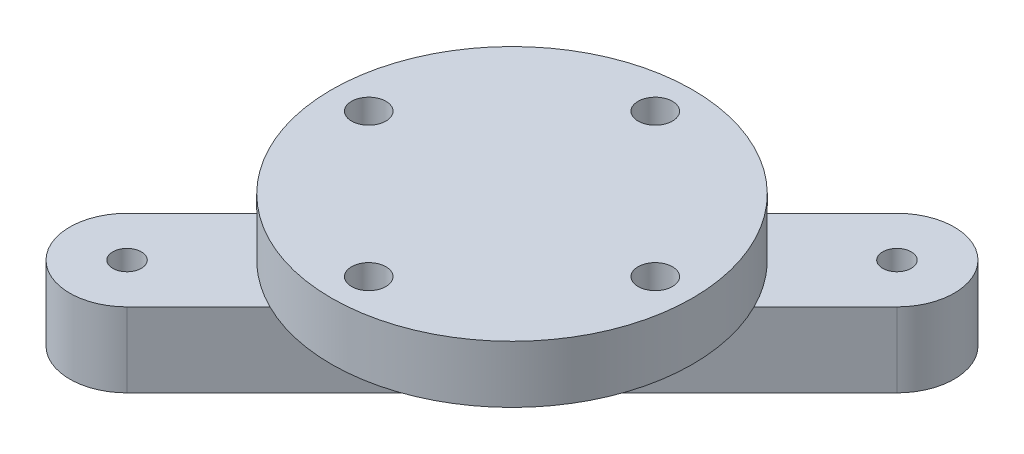
from build123d import *

# Parameters (mm, degrees)
SKETCH1_R           = 31.5
BOSS_EXTRUDE4_DEPTH = 10
SKETCH3_R           = 3
CUT_EXTRUDE2_DEPTH  = 10
SKETCH4_R           = 5
CUT_EXTRUDE3_DEPTH  = 5
SKETCH5_R           = 2.5
BOSS_EXTRUDE5_DEPTH = 13


with BuildPart() as part:
    # Sketch1 → Boss-Extrude4 (new body)
    with BuildSketch(Plane(origin=(0, 0, 0), x_dir=(1, 0, 0), z_dir=(0, 1, 0))):
        with Locations(Location((0, 0, 0), (0, 0, 270))):
            Circle(SKETCH1_R)
    extrude(amount=BOSS_EXTRUDE4_DEPTH)

    # Sketch3 → Cut-Extrude2 (cut)
    with BuildSketch(Plane(origin=(0, 0, 0), x_dir=(1, 0, 0), z_dir=(0, 1, 0))):
        with Locations(Location((0, 25, 0), (0, 0, 270))):
            Circle(SKETCH3_R)
        with Locations(Location((25, 0, 0), (0, 0, 270))):
            Circle(SKETCH3_R)
        with Locations(Location((0, -25, 0), (0, 0, 270))):
            Circle(SKETCH3_R)
        with Locations(Location((-25, 0, 0), (0, 0, 270))):
            Circle(SKETCH3_R)
    extrude(amount=CUT_EXTRUDE2_DEPTH, mode=Mode.SUBTRACT)

    # Sketch4 → Cut-Extrude3 (cut)
    with BuildSketch(Plane(origin=(0, 0, 0), x_dir=(1, 0, 0), z_dir=(0, 1, 0))):
        with Locations(Location((0, 25, 0), (0, 0, 270))):
            Circle(SKETCH4_R)
        with Locations(Location((25, 0, 0), (0, 0, 270))):
            Circle(SKETCH4_R)
        with Locations(Location((0, -25, 0), (0, 0, 270))):
            Circle(SKETCH4_R)
        with Locations(Location((-25, 0, 0), (0, 0, 270))):
            Circle(SKETCH4_R)
    extrude(amount=CUT_EXTRUDE3_DEPTH, mode=Mode.SUBTRACT)

    # Sketch5 → Boss-Extrude5 (add)
    with BuildSketch(Plane(origin=(0, 0, 0), x_dir=(1, 0, 0), z_dir=(0, 1, 0))):
        with BuildLine():
            Line((-40.658639918, -26.516504294), (26.516504294, 40.658639918))
            ThreePointArc((26.516504294, 40.658639918), (40.658639918, 40.658639918), (40.658639918, 26.516504294))
            Line((40.658639918, 26.516504294), (-26.516504294, -40.658639918))
            ThreePointArc((-26.516504294, -40.658639918), (-40.658639918, -40.658639918), (-40.658639918, -26.516504294))
        make_face()
        with Locations(Location((-33.587572106, -33.587572106, 0), (0, 0, 270))):
            Circle(SKETCH5_R, mode=Mode.SUBTRACT)
        with Locations(Location((33.587572106, 33.587572106, 0), (0, 0, 270))):
            Circle(SKETCH5_R, mode=Mode.SUBTRACT)
    extrude(amount=-BOSS_EXTRUDE5_DEPTH)


solid = part.part
